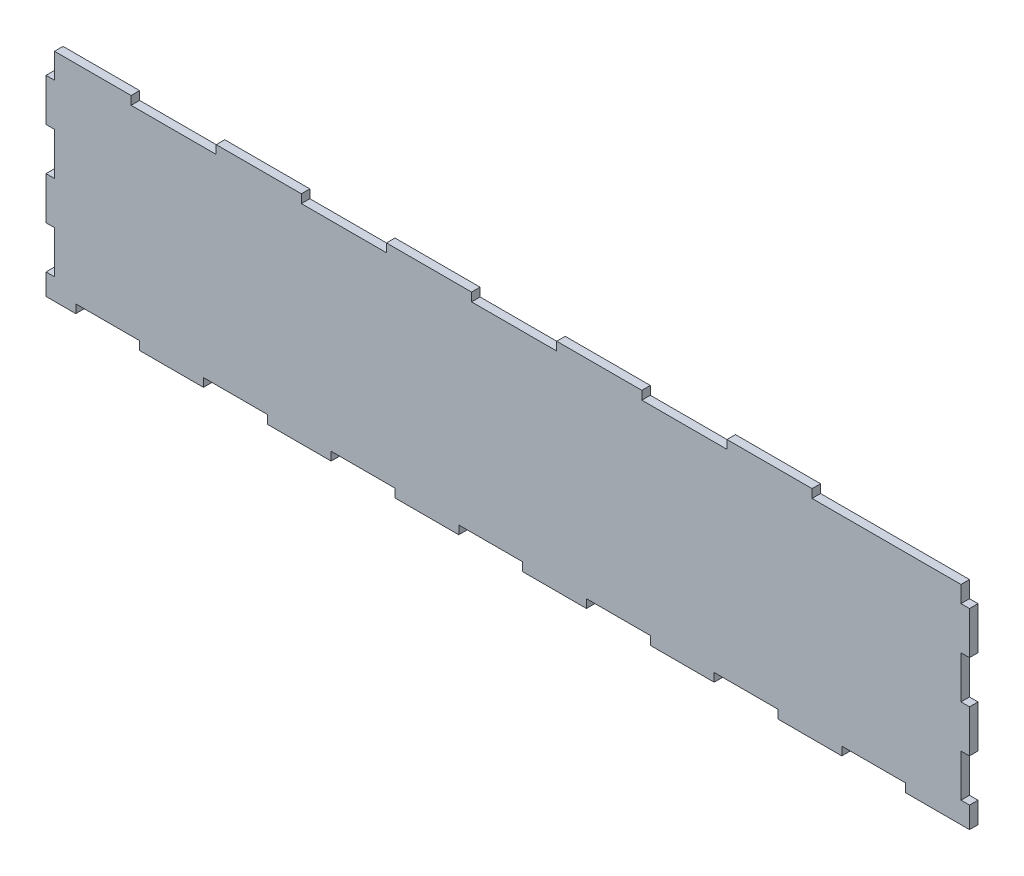
from build123d import *

# Parameters (mm, degrees)
SKETCH1_W               = 275.57984
SKETCH1_H               = 62.103
BOSS_EXTRUDE1_DEPTH     = 2.54
SKETCH2_W               = 25.4
SKETCH2_H               = 2.54
BOSS_EXTRUDE2_DEPTH     = 2.54
LPATTERN1_COUNT         = 5
LPATTERN1_PITCH         = 50.8
SKETCH3_W               = 2.54
SKETCH3_H               = 12.7
CUT_EXTRUDE1_DEPTH      = 142.848167157
LPATTERN3_COUNT         = 3
LPATTERN3_PITCH         = 25.4
MIRROR1_COPY_1_SKETCH_W = 2.54
MIRROR1_COPY_1_SKETCH_H = 12.7
MIRROR1_COPY_1_DEPTH    = 142.848167157
MIRROR1_COPY_2_SKETCH_W = 2.54
MIRROR1_COPY_2_SKETCH_H = 12.7
MIRROR1_COPY_2_DEPTH    = 142.848167157
SKETCH5_W               = 19.05
SKETCH5_H               = 2.54
CUT_EXTRUDE3_DEPTH      = 142.848167157
LPATTERN5_COUNT         = 8
LPATTERN5_PITCH         = 38.1


with BuildPart() as part:
    # Sketch1 → Boss-Extrude1 (new body)
    with BuildSketch(Plane.XY):
        Rectangle(SKETCH1_W, SKETCH1_H)
    extrude(amount=BOSS_EXTRUDE1_DEPTH)

    # Sketch2 → Boss-Extrude2 (add)
    with BuildSketch(Plane.XY.offset(2.54)):
        with Locations((-125.08992, 32.3215)):
            Rectangle(SKETCH2_W, SKETCH2_H)
    boss_extrude2 = extrude(amount=-BOSS_EXTRUDE2_DEPTH)

    # LPattern1: Boss-Extrude2 ×5
    with Locations(*[(i * LPATTERN1_PITCH, 0, 0) for i in range(1, LPATTERN1_COUNT)]):
        add(boss_extrude2)

    # Sketch3 → Cut-Extrude1 (cut, through all)
    with BuildSketch(Plane.XY.offset(2.54)):
        with Locations((-136.51992, -18.3515)):
            Rectangle(SKETCH3_W, SKETCH3_H)
    cut_extrude1 = extrude(amount=-CUT_EXTRUDE1_DEPTH, mode=Mode.SUBTRACT)

    # LPattern3: Cut-Extrude1 ×3
    with Locations(*[(0, i * LPATTERN3_PITCH, 0) for i in range(1, LPATTERN3_COUNT)]):
        add(cut_extrude1, mode=Mode.SUBTRACT)

    # Mirror1: Cut-Extrude1 across plane
    add(cut_extrude1.mirror(Plane(origin=(0, 0, 0), x_dir=(0, 0, 1), z_dir=(1, 0, 0))), mode=Mode.SUBTRACT)

    # Mirror1 copy 1 sketch → Mirror1 copy 1 (cut, through all)
    with BuildSketch(Plane(origin=(0, 25.4, 2.54), x_dir=(-1, 0, 0), z_dir=(0, 0, 1))):
        with Locations((-136.51992, 18.3515)):
            Rectangle(MIRROR1_COPY_1_SKETCH_W, MIRROR1_COPY_1_SKETCH_H)
    extrude(amount=-MIRROR1_COPY_1_DEPTH, mode=Mode.SUBTRACT)

    # Mirror1 copy 2 sketch → Mirror1 copy 2 (cut, through all)
    with BuildSketch(Plane(origin=(0, 50.8, 2.54), x_dir=(-1, 0, 0), z_dir=(0, 0, 1))):
        with Locations((-136.51992, 18.3515)):
            Rectangle(MIRROR1_COPY_2_SKETCH_W, MIRROR1_COPY_2_SKETCH_H)
    extrude(amount=-MIRROR1_COPY_2_DEPTH, mode=Mode.SUBTRACT)

    # Sketch5 → Cut-Extrude3 (cut, through all)
    with BuildSketch(Plane.XY.offset(2.54)):
        with Locations((-119.38508, -29.7815)):
            Rectangle(SKETCH5_W, SKETCH5_H)
    cut_extrude3 = extrude(amount=-CUT_EXTRUDE3_DEPTH, mode=Mode.SUBTRACT)

    # LPattern5: Cut-Extrude3 ×8
    with Locations(*[(i * LPATTERN5_PITCH, 0, 0) for i in range(1, LPATTERN5_COUNT)]):
        add(cut_extrude3, mode=Mode.SUBTRACT)


solid = part.part
